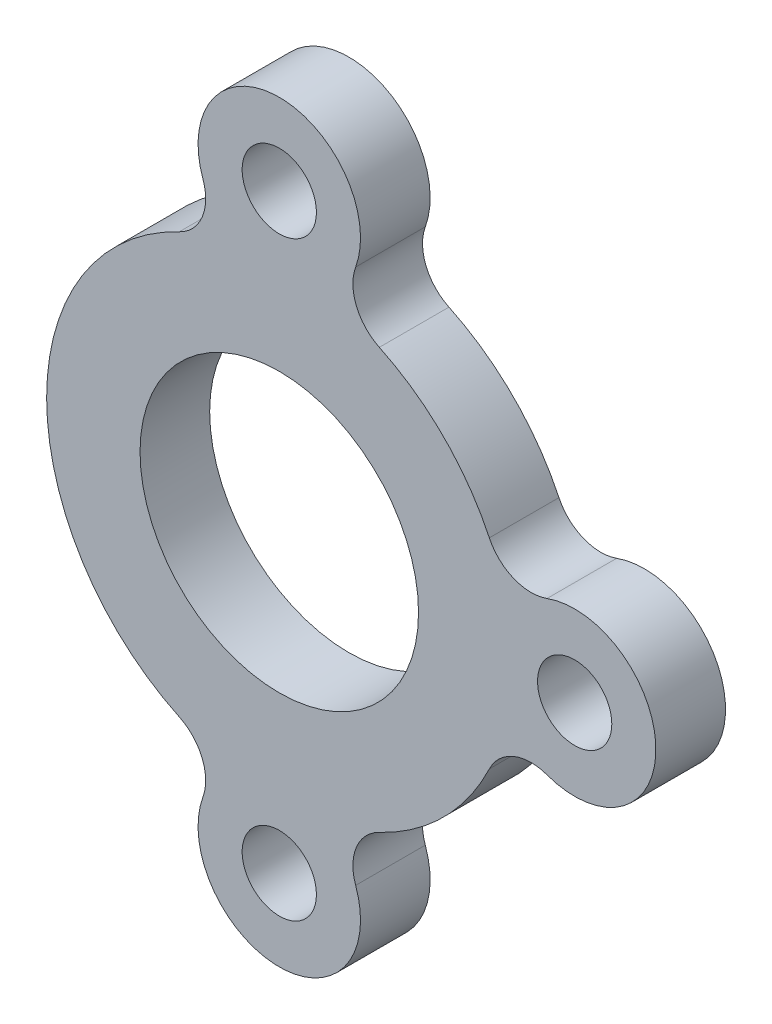
from build123d import *

# Parameters (mm, degrees)
SKETCH1_R           = 1.6
SKETCH1_R_2         = 6
BOSS_EXTRUDE1_DEPTH = 3


with BuildPart() as part:
    # Sketch1 → Boss-Extrude1 (new body)
    with BuildSketch(Plane.XY):
        with BuildLine():
            ThreePointArc((13.513146708, -41.545306592), (16.804211194, -46.236480195), (20.095275679, -41.545306592))
            ThreePointArc((20.095275679, -41.545306592), (20.125665024, -40.105234948), (21.115730483, -39.059051292))
            ThreePointArc((21.115730483, -39.059051292), (23.892956675, -37.097303615), (25.854704352, -34.320077422))
            ThreePointArc((25.854704352, -34.320077422), (26.900888008, -33.330011964), (28.340959652, -33.299622619))
            ThreePointArc((28.340959652, -33.299622619), (33.032133255, -30.008558133), (28.340959652, -26.717493648))
            ThreePointArc((28.340959652, -26.717493648), (26.900888008, -26.687104303), (25.854704352, -25.697038844))
            ThreePointArc((25.854704352, -25.697038844), (23.892956675, -22.919812652), (21.115730483, -20.958064974))
            ThreePointArc((21.115730483, -20.958064974), (20.125665024, -19.911881319), (20.095275679, -18.471809674))
            ThreePointArc((20.095275679, -18.471809674), (16.804211194, -13.780636072), (13.513146708, -18.471809674))
            ThreePointArc((13.513146708, -18.471809674), (13.482757363, -19.911881319), (12.492691904, -20.958064974))
            ThreePointArc((12.492691904, -20.958064974), (6.779211194, -30.008558133), (12.492691904, -39.059051292))
            ThreePointArc((12.492691904, -39.059051292), (13.482757363, -40.105234948), (13.513146708, -41.545306592))
        make_face()
        with Locations((16.804211194, -17.280636072)):
            Circle(SKETCH1_R, mode=Mode.SUBTRACT)
        with Locations((16.804211194, -30.008558133)):
            Circle(SKETCH1_R_2, mode=Mode.SUBTRACT)
        with Locations((16.804211194, -42.736480195)):
            Circle(SKETCH1_R, mode=Mode.SUBTRACT)
        with Locations((29.532133255, -30.008558133)):
            Circle(SKETCH1_R, mode=Mode.SUBTRACT)
    extrude(amount=BOSS_EXTRUDE1_DEPTH)


solid = part.part
